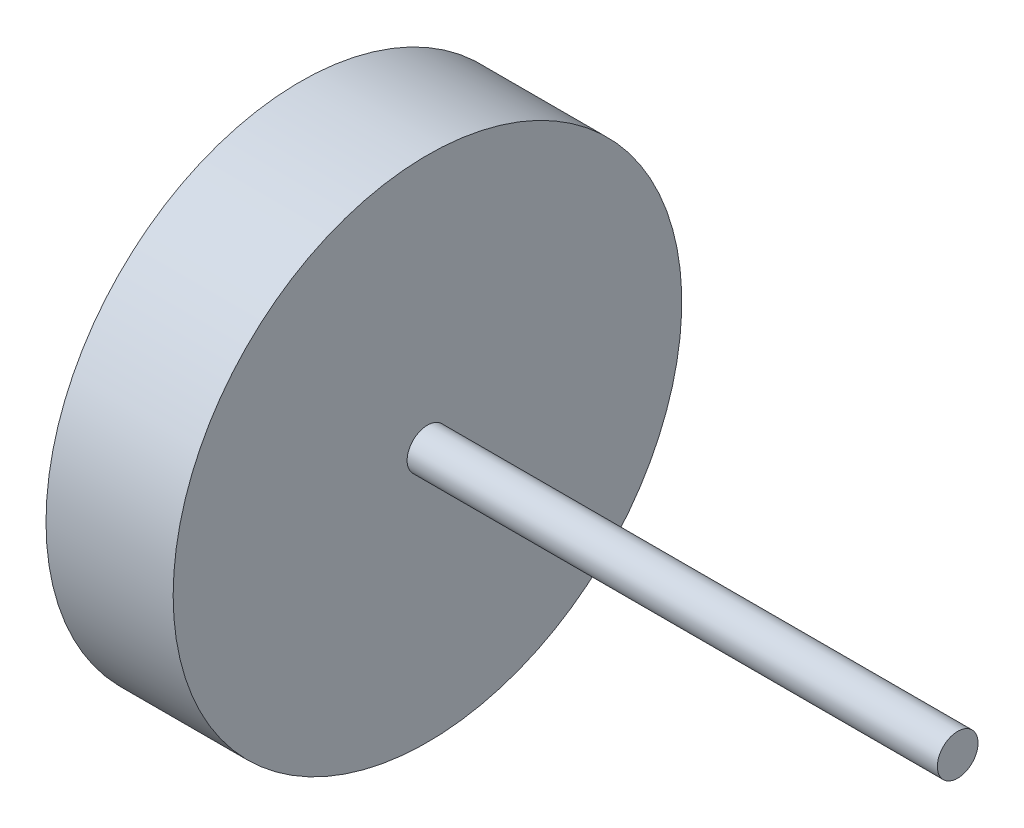
from build123d import *

# Parameters (mm, degrees)
SKETCH2_R           = 50
BOSS_EXTRUDE1_DEPTH = 25
SKETCH3_R           = 4
BOSS_EXTRUDE2_DEPTH = 129.25


with BuildPart() as part:
    # Sketch2 → Boss-Extrude1 (new body)
    with BuildSketch(Plane(origin=(-140.25, 0, -252.75), x_dir=(0, 0, 1), z_dir=(-1, 0, 0))):
        Circle(SKETCH2_R)
    extrude(amount=-BOSS_EXTRUDE1_DEPTH)

    # Sketch3 → Boss-Extrude2 (add)
    with BuildSketch(Plane(origin=(-140.25, 0, -252.75), x_dir=(0, 0, 1), z_dir=(-1, 0, 0))):
        Circle(SKETCH3_R)
    extrude(amount=-BOSS_EXTRUDE2_DEPTH)


solid = part.part
